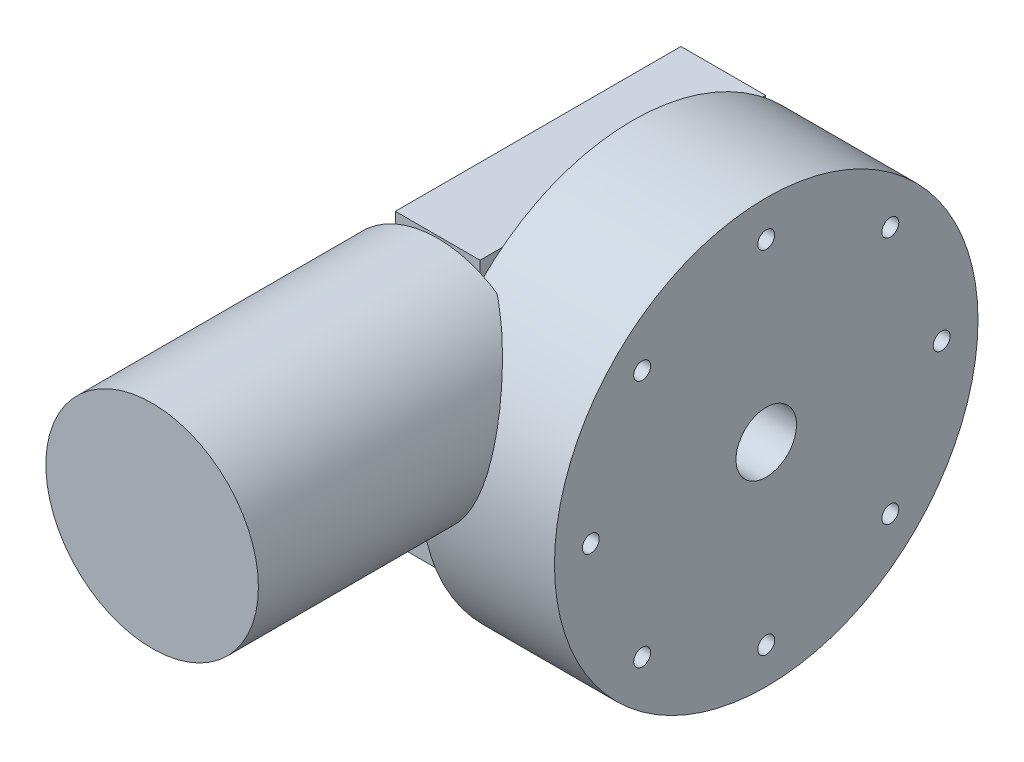
from build123d import *

# Parameters (mm, degrees)
SKETCH1_R           = 175
BOSS_EXTRUDE1_DEPTH = 110.5
SKETCH2_R           = 7
CUT_EXTRUDE1_DEPTH  = 272.035514278
CIRPATTERN1_COUNT   = 8
SKETCH4_W           = 236
SKETCH4_H           = 238.523478567
BOSS_EXTRUDE2_DEPTH = 70
SKETCH5_R           = 87.828068046
BOSS_EXTRUDE3_DEPTH = 236
SKETCH6_R           = 25
CUT_EXTRUDE2_DEPTH  = 465.877389575


with BuildPart() as part:
    # Sketch1 → Boss-Extrude1 (new body)
    with BuildSketch(Plane(origin=(0, 0, 0), x_dir=(0, 0, -1), z_dir=(1, 0, 0))):
        Circle(SKETCH1_R)
    extrude(amount=BOSS_EXTRUDE1_DEPTH)

    # Sketch2 → Cut-Extrude1 (cut, through all)
    with BuildSketch(Plane.ZY):
        with Locations((0, 145)):
            Circle(SKETCH2_R)
    cut_extrude1 = extrude(amount=-CUT_EXTRUDE1_DEPTH, mode=Mode.SUBTRACT)

    # CirPattern1: Cut-Extrude1 ×8 about axis
    cirpattern1_axis = Axis((0, 0, 0), (1, 0, 0))
    for i in range(1, CIRPATTERN1_COUNT):
        add(cut_extrude1.rotate(cirpattern1_axis, i * 360 / CIRPATTERN1_COUNT), mode=Mode.SUBTRACT)


with BuildPart() as body_2:
    # Sketch4 → Boss-Extrude2 (new body)
    with BuildSketch(Plane(origin=(0, 0, 0), x_dir=(0, 0, -1), z_dir=(1, 0, 0))):
        with Locations((-8, 18.738260716)):
            Rectangle(SKETCH4_W, SKETCH4_H)
    extrude(amount=-BOSS_EXTRUDE2_DEPTH)

    # Sketch5 → Boss-Extrude3 (add)
    with BuildSketch(Plane.XY.offset(126)):
        with Locations(Location((-35, 48.397201252, 0), (0, 0, 113.484805898))):
            Circle(SKETCH5_R)
    extrude(amount=BOSS_EXTRUDE3_DEPTH)


with BuildPart() as cut_extrude2_tool:
    # Sketch6 → Cut-Extrude2 (new, through all)
    with BuildSketch(Plane(origin=(110.5, 0, 0), x_dir=(0, 0, -1), z_dir=(1, 0, 0))):
        Circle(SKETCH6_R)
    extrude(amount=-CUT_EXTRUDE2_DEPTH)


with BuildPart() as part_1:
    add(part.part)

    # Cut-Extrude2: cut by cut_extrude2_tool
    add(cut_extrude2_tool.part, mode=Mode.SUBTRACT)


with BuildPart() as body_2_1:
    add(body_2.part)

    # Cut-Extrude2: cut by cut_extrude2_tool
    add(cut_extrude2_tool.part, mode=Mode.SUBTRACT)


solid = Compound([part_1.part, body_2_1.part])
